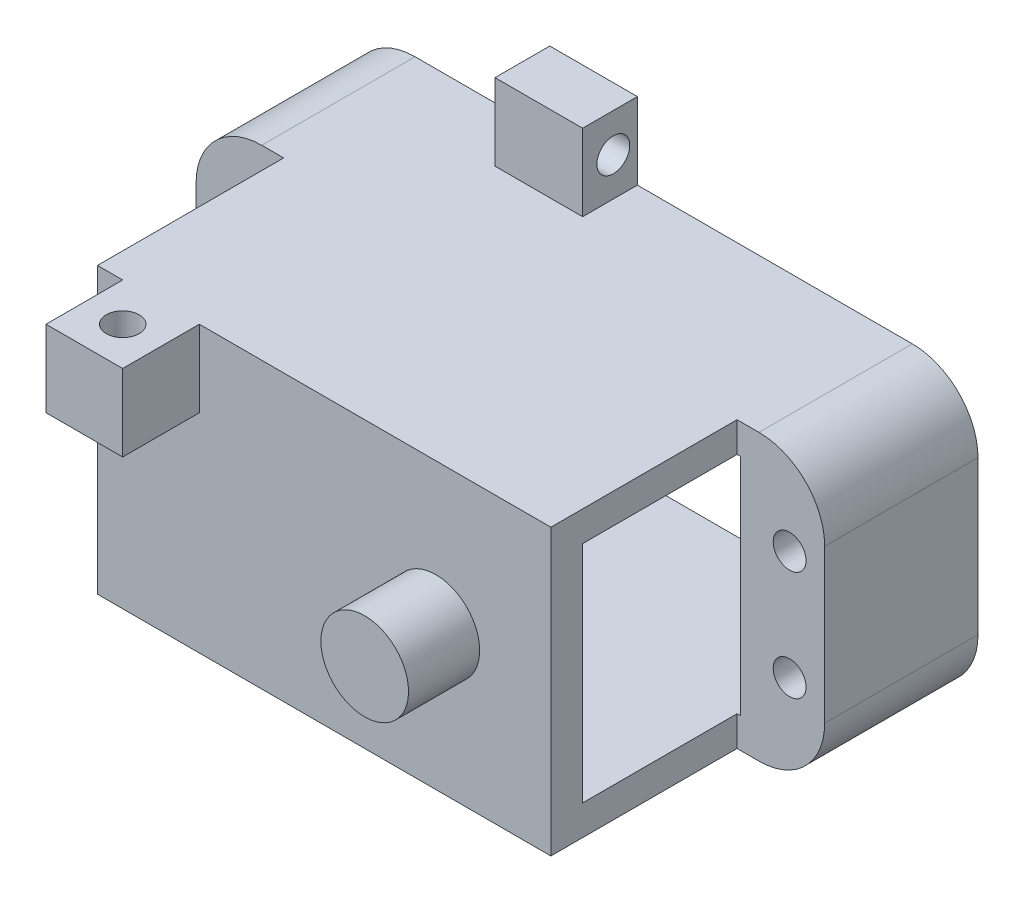
from build123d import *

# Parameters (mm, degrees)
SKETCH_1_W          = 57.4
SKETCH_1_H          = 26
EXTRUDE_1_DEPTH     = 31
SKETCH_3_W          = 42
SKETCH_3_H          = 20.5
CUT_EXTRUDE_1_DEPTH = 28.1
EXTRUDE_START       = 31
SKETCH_5_W          = 7
SKETCH_5_H          = 7
EXTRUDE_2_DEPTH     = 7
SKETCH_6_W          = 8
SKETCH_6_H          = 7
EXTRUDE_3_DEPTH     = 5
SKETCH_7_R          = 1.5
CUT_EXTRUDE_2_DEPTH = 7
SKETCH_8_R          = 1.5
CUT_EXTRUDE_3_DEPTH = 8
CUT_EXTRUDE_4_DEPTH = 8
CUT_EXTRUDE_7_REACH = 53.65
SKETCH_14_R         = 1.5
FILLET_1_R          = 6
SKETCH_15_R         = 4
EXTRUDE_4_DEPTH     = 6.5


with BuildPart() as part:
    # Эскиз1 → Бобышка-Вытянуть1 (new body)
    with BuildSketch(Plane.XY):
        Rectangle(SKETCH_1_W, SKETCH_1_H)
    extrude(amount=EXTRUDE_1_DEPTH)

    # Эскиз3 → Вырез-Вытянуть1 (cut)
    with BuildSketch(Plane.XY):
        Rectangle(SKETCH_3_W, SKETCH_3_H)
    extrude(amount=CUT_EXTRUDE_1_DEPTH, mode=Mode.SUBTRACT)

    # Эскиз5 → Бобышка-Вытянуть2 (add)
    with BuildSketch(Plane.XY.offset(EXTRUDE_START)):
        with Locations((-14.9, 9.5)):
            Rectangle(SKETCH_5_W, SKETCH_5_H)
    extrude(amount=EXTRUDE_2_DEPTH)

    # Эскиз6 → Бобышка-Вытянуть3 (add)
    with BuildSketch(Plane.XY):
        with Locations((-6.4, 16.5)):
            Rectangle(SKETCH_6_W, SKETCH_6_H)
    extrude(amount=EXTRUDE_3_DEPTH)

    # Эскиз7 → Вырез-Вытянуть2 (cut)
    with BuildSketch(Plane(origin=(0, 13, 0), x_dir=(1, 0, 0), z_dir=(0, 1, 0))):
        with Locations(Location((-14.9, -34.5, 0), (0, 0, 270))):
            Circle(SKETCH_7_R)
    extrude(amount=-CUT_EXTRUDE_2_DEPTH, mode=Mode.SUBTRACT)

    # Эскиз8 → Вырез-Вытянуть3 (cut)
    with BuildSketch(Plane.ZY.offset(10.4)):
        with Locations(Location((2.2, 16.5, 0), (0, 0, 270))):
            Circle(SKETCH_8_R)
    extrude(amount=-CUT_EXTRUDE_3_DEPTH, mode=Mode.SUBTRACT)

    # Эскиз10 → Вырез-Вытянуть4 (cut)
    with BuildSketch(Plane.ZY.offset(28.7)):
        Polygon((14, 13), (14, 0), (14, -13), (31, -13), (31, 13), align=None)
    cut_extrude_4 = extrude(amount=-CUT_EXTRUDE_4_DEPTH, mode=Mode.SUBTRACT)

    # Зеркальное отражение1: Вырез-Вытянуть4 across plane
    add(cut_extrude_4.mirror(Plane(origin=(0, 0, 0), x_dir=(0, 0, 1), z_dir=(1, 0, 0))), mode=Mode.SUBTRACT)

    # Эскиз14 → Вырез-Вытянуть7 (cut, up to next)
    with BuildSketch(Plane(origin=(0, 0, 0), x_dir=(-1, 0, 0), z_dir=(0, 0, -1)), mode=Mode.PRIVATE) as cut_extrude_7_sk1:
        with Locations((-25.5, 5)):
            Circle(SKETCH_14_R)
    cut_extrude_7_tool1 = extrude(cut_extrude_7_sk1.sketch, amount=-CUT_EXTRUDE_7_REACH, mode=Mode.PRIVATE) & part.part
    # Эскиз14 → Вырез-Вытянуть7 (cut, up to next)
    with BuildSketch(Plane(origin=(0, 0, 0), x_dir=(-1, 0, 0), z_dir=(0, 0, -1)), mode=Mode.PRIVATE) as cut_extrude_7_sk2:
        with Locations((-25.5, -5)):
            Circle(SKETCH_14_R)
    cut_extrude_7_tool2 = extrude(cut_extrude_7_sk2.sketch, amount=-CUT_EXTRUDE_7_REACH, mode=Mode.PRIVATE) & part.part
    cut_extrude_7_1 = cut_extrude_7_tool1.solids().sort_by_distance((25.5, 5, 0))[0]
    add(cut_extrude_7_1, mode=Mode.SUBTRACT)
    cut_extrude_7_2 = cut_extrude_7_tool2.solids().sort_by_distance((25.5, -5, 0))[0]
    add(cut_extrude_7_2, mode=Mode.SUBTRACT)
    cut_extrude_7 = cut_extrude_7_1 + cut_extrude_7_2  # Вырез-Вытянуть7 as one shape, for the pattern or mirror that repeats it

    # Зеркальное отражение3: Вырез-Вытянуть7 across plane
    add(cut_extrude_7.mirror(Plane(origin=(0, 0, 0), x_dir=(0, 0, 1), z_dir=(1, 0, 0))), mode=Mode.SUBTRACT)

    # Скругление1
    fillet_1_edges = [part.edges().sort_by_distance(p)[0] for p in [
        (-28.7, -13, 7),
        (-28.7, 13, 7),
        (28.7, 13, 7),
        (28.7, -13, 7),
    ]]
    fillet(fillet_1_edges, radius=FILLET_1_R)

    # Эскиз15 → Бобышка-Вытянуть4 (add)
    with BuildSketch(Plane.XY.offset(31)):
        with Locations(Location((10.2, 0, 0), (0, 0, 180))):
            Circle(SKETCH_15_R)
    extrude(amount=EXTRUDE_4_DEPTH)


solid = part.part
